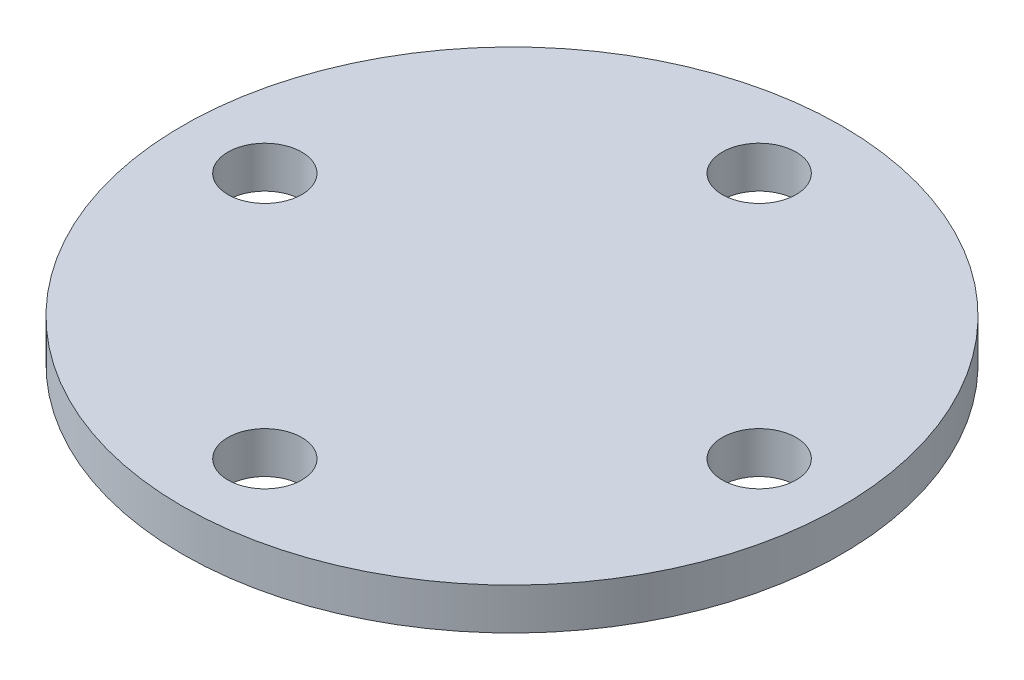
from build123d import *

# Parameters (mm, degrees)
SKETCH1_R           = 12.7
BOSS_EXTRUDE1_DEPTH = 1.6002
SKETCH2_R           = 1.4224
CUT_EXTRUDE1_DEPTH  = 1.6002
CIRPATTERN1_COUNT   = 4


with BuildPart() as part:
    # Sketch1 → Boss-Extrude1 (new body)
    with BuildSketch(Plane(origin=(0, 0, 0), x_dir=(1, 0, 0), z_dir=(0, 1, 0))):
        Circle(SKETCH1_R)
    extrude(amount=BOSS_EXTRUDE1_DEPTH)

    # Sketch2 → Cut-Extrude1 (cut)
    with BuildSketch(Plane(origin=(0, 1.6002, 0), x_dir=(1, 0, 0), z_dir=(0, 1, 0))):
        with Locations((-9.525, 0)):
            Circle(SKETCH2_R)
    cut_extrude1 = extrude(amount=-CUT_EXTRUDE1_DEPTH, mode=Mode.SUBTRACT)

    # CirPattern1: Cut-Extrude1 ×4 about axis
    cirpattern1_axis = Axis((0, 1.6002, 0), (0, -1, 0))
    for i in range(1, CIRPATTERN1_COUNT):
        add(cut_extrude1.rotate(cirpattern1_axis, i * 360 / CIRPATTERN1_COUNT), mode=Mode.SUBTRACT)


solid = part.part
